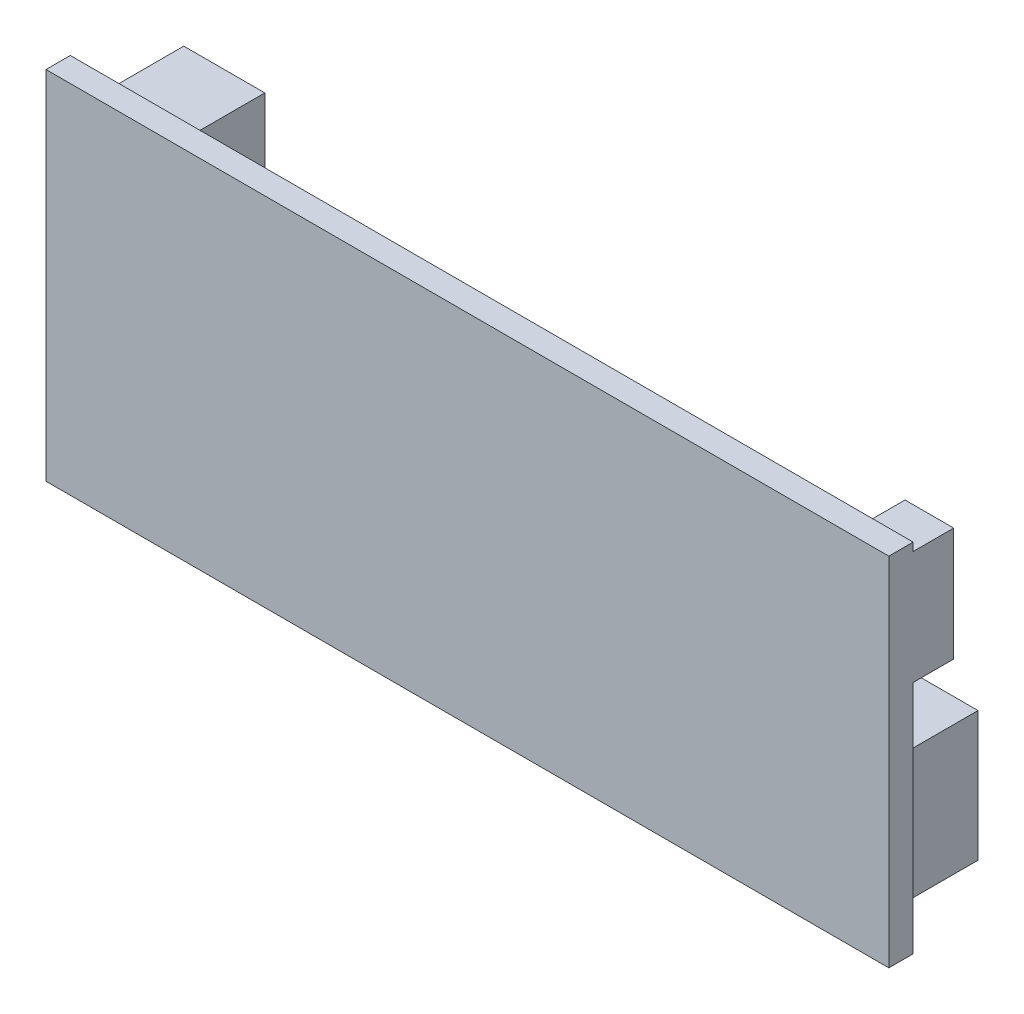
from build123d import *

# Parameters (mm, degrees)
SKETCH1_W           = 52
SKETCH1_H           = 22
BOSS_EXTRUDE1_DEPTH = 1.5
SKETCH2_W           = 5
SKETCH2_H           = 5
SKETCH2_W_2         = 10
SKETCH2_H_2         = 8
SKETCH2_W_3         = 3
SKETCH2_H_3         = 7
SKETCH2_W_4         = 1.5
SKETCH2_H_4         = 4.802137959
BOSS_EXTRUDE2_DEPTH = 2.5
SKETCH3_W           = 10
SKETCH3_H           = 8
SKETCH3_W_2         = 1.5
SKETCH3_H_2         = 4.802137959
SKETCH3_W_3         = 5
SKETCH3_H_3         = 5
BOSS_EXTRUDE3_DEPTH = 3


with BuildPart() as part:
    # Sketch1 → Boss-Extrude1 (new body)
    with BuildSketch(Plane.XY):
        with Locations((6.718487395, 11)):
            Rectangle(SKETCH1_W, SKETCH1_H)
    extrude(amount=BOSS_EXTRUDE1_DEPTH)

    # Sketch2 → Boss-Extrude2 (add)
    with BuildSketch(Plane(origin=(0, 0, 0), x_dir=(-1, 0, 0), z_dir=(0, 0, -1))):
        with Locations((15.281512605, 18)):
            Rectangle(SKETCH2_W, SKETCH2_H)
        with Locations((-26.218487395, 5.5)):
            Rectangle(SKETCH2_W_2, SKETCH2_H_2)
        with Locations((-31.218487395, 18)):
            Rectangle(SKETCH2_W_3, SKETCH2_H_3)
        with Locations((18.531512605, 5.498931021)):
            Rectangle(SKETCH2_W_4, SKETCH2_H_4)
    extrude(amount=BOSS_EXTRUDE2_DEPTH)

    # Sketch3 → Boss-Extrude3 (add)
    with BuildSketch(Plane(origin=(0, 0, -2.5), x_dir=(-1, 0, 0), z_dir=(0, 0, -1))):
        with Locations((-26.218487395, 5.5)):
            Rectangle(SKETCH3_W, SKETCH3_H)
        with Locations((18.531512605, 5.498931021)):
            Rectangle(SKETCH3_W_2, SKETCH3_H_2)
        with Locations((15.281512605, 18)):
            Rectangle(SKETCH3_W_3, SKETCH3_H_3)
    extrude(amount=BOSS_EXTRUDE3_DEPTH)


solid = part.part
